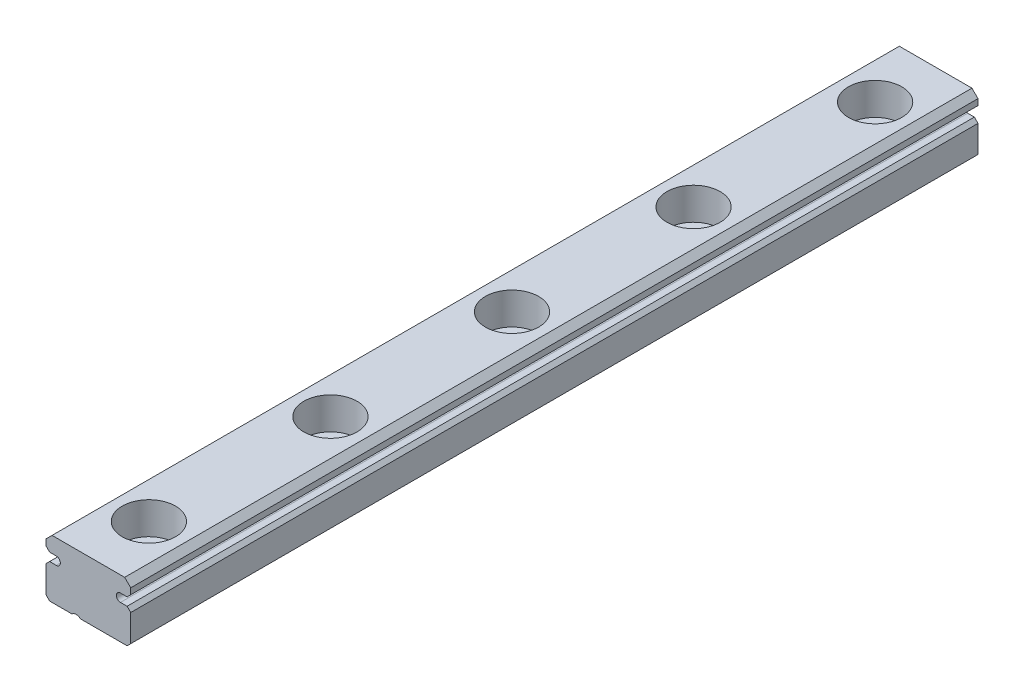
from build123d import *

# Parameters (mm, degrees)
BOSS_EXTRUDE1_DEPTH            = 35
CHAMFER1_SIZE                  = 0.5
CHAMFER2_SIZE                  = 0.3
CBORE_FOR_M2_SHCS1_D           = 2.4
CBORE_FOR_M2_SHCS1_CBORE_D     = 4.4
CBORE_FOR_M2_SHCS1_CBORE_DEPTH = 2.65
LPATTERN1_COUNT                = 5
LPATTERN1_PITCH                = 15


with BuildPart() as part:
    # Sketch3 → Boss-Extrude1 (new, symmetric)
    with BuildSketch(Plane.XY):
        with BuildLine():
            Line((-3.5, 0), (-1.35, 0))
            ThreePointArc((-1.35, 0), (-1, 0.142928579), (-0.65, 0))
            Line((-0.65, 0), (3.5, 0))
            Line((3.5, 0), (3.5, 2.83))
            Line((3.5, 2.83), (2.65, 2.83))
            ThreePointArc((2.65, 2.83), (2.315, 3.165), (2.65, 3.5))
            Line((2.65, 3.5), (3.5, 3.5))
            Line((3.5, 3.5), (3.5, 4.8))
            Line((3.5, 4.8), (-3.5, 4.8))
            Line((-3.5, 4.8), (-3.5, 3.5))
            Line((-3.5, 3.5), (-2.65, 3.5))
            ThreePointArc((-2.65, 3.5), (-2.315, 3.165), (-2.65, 2.83))
            Line((-2.65, 2.83), (-3.5, 2.83))
            Line((-3.5, 2.83), (-3.5, 0))
        make_face()
    extrude(amount=BOSS_EXTRUDE1_DEPTH, both=True)

    # Chamfer1
    chamfer1_edges = [part.edges().sort_by_distance(p)[0] for p in [
        (-3.5, 4.8, 0),
        (3.5, 4.8, 0),
    ]]
    chamfer(chamfer1_edges, length=CHAMFER1_SIZE)

    # Chamfer2
    chamfer2_edges = [part.edges().sort_by_distance(p)[0] for p in [
        (-3.5, 2.83, 0),
        (-3.5, 3.5, 0),
        (3.5, 3.5, 0),
        (3.5, 2.83, 0),
        (3.5, 0, 0),
        (-3.5, 0, 0),
    ]]
    chamfer(chamfer2_edges, length=CHAMFER2_SIZE)

    # CBORE for M2 SHCS1 (through all)
    with Locations(Plane(origin=(0, 4.8, 0), x_dir=(1, 0, 0), z_dir=(0, 1, 0))):
        with Locations((0, -30)):
            cbore_for_m2_shcs1 = CounterBoreHole(CBORE_FOR_M2_SHCS1_D / 2, CBORE_FOR_M2_SHCS1_CBORE_D / 2, CBORE_FOR_M2_SHCS1_CBORE_DEPTH)

    # LPattern1: CBORE for M2 SHCS1 ×5
    with Locations(*[(0, 0, -i * LPATTERN1_PITCH) for i in range(1, LPATTERN1_COUNT)]):
        add(cbore_for_m2_shcs1, mode=Mode.SUBTRACT)


solid = part.part
